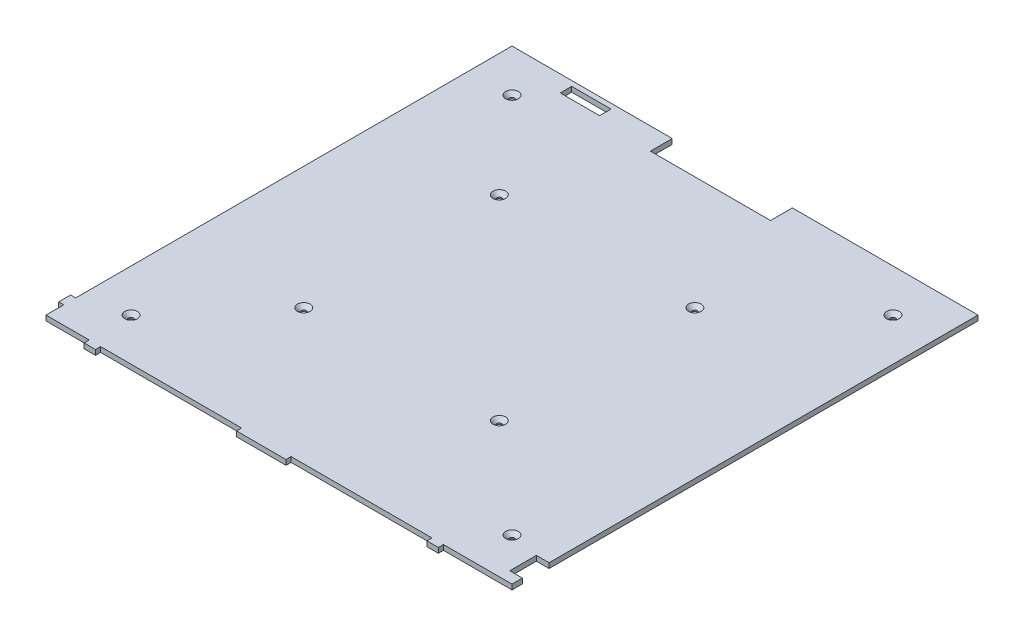
from build123d import *

# Parameters (mm, degrees)
BOSS_EXTRUDE1_DEPTH = 2
SKETCH2_R           = 1
CUT_EXTRUDE1_DEPTH  = 133.597605559
CHAMFER1_SIZE       = 1.5
SKETCH3_W           = 15.5
SKETCH3_H           = 4.5
CUT_EXTRUDE2_DEPTH  = 133.597605559
SKETCH4_W           = 8
SKETCH4_H           = 40
CUT_EXTRUDE3_DEPTH  = 1.3


with BuildPart() as part:
    # Sketch1 → Boss-Extrude1 (new body)
    with BuildSketch(Plane(origin=(0, 0, 0), x_dir=(1, 0, 0), z_dir=(0, 1, 0))):
        Polygon((-74.75, -93.75), (-70.25, -93.75), (-70.25, -91.75), (-14.75, -91.75), (-14.75, -93.75), (4.75, -93.75), (4.75, -91.75), (60.25, -91.75), (60.25, -93.75), (64.75, -93.75), (64.75, -91.75), (91.75, -91.75), (91.75, -87.65), (86.75, -87.65), (86.75, -77.15), (91.75, -77.15), (91.75, 91.75), (18.65, 91.75), (18.65, 83.15), (-28.65, 83.15), (-28.65, 91.75), (-91.75, 91.75), (-91.75, -80.05), (-93.75, -80.05), (-93.75, -84.75), (-91.75, -84.75), (-91.75, -91.75), (-74.75, -91.75), align=None)
    extrude(amount=BOSS_EXTRUDE1_DEPTH)

    # Sketch2 → Cut-Extrude1 (cut, through all)
    with BuildSketch(Plane.XZ):
        with Locations(Location((75, -75, 0), (0, 0, 270))):
            Circle(SKETCH2_R)
        with Locations(Location((-75, -75, 0), (0, 0, 270))):
            Circle(SKETCH2_R)
        with Locations(Location((-75, 75, 0), (0, 0, 270))):
            Circle(SKETCH2_R)
        with Locations(Location((75, 75, 0), (0, 0, 270))):
            Circle(SKETCH2_R)
        with Locations(Location((33.5, 38.5, 0), (0, 0, 270))):
            Circle(SKETCH2_R)
        with Locations(Location((-43.5, 38.5, 0), (0, 0, 270))):
            Circle(SKETCH2_R)
        with Locations(Location((-43.5, -38.5, 0), (0, 0, 270))):
            Circle(SKETCH2_R)
        with Locations(Location((33.5, -38.5, 0), (0, 0, 270))):
            Circle(SKETCH2_R)
    extrude(amount=-CUT_EXTRUDE1_DEPTH, mode=Mode.SUBTRACT)

    # Chamfer1
    chamfer1_edges = [part.edges().sort_by_distance(p)[0] for p in [
        (-75, 2, -74),
        (-75, 2, 76),
        (75, 2, 76),
        (33.5, 2, 39.5),
        (-43.5, 2, 39.5),
        (-43.5, 2, -37.5),
        (33.5, 2, -37.5),
        (75, 2, -74),
    ]]
    chamfer(chamfer1_edges, length=CHAMFER1_SIZE)

    # Sketch3 → Cut-Extrude2 (cut, through all)
    with BuildSketch(Plane.XZ):
        with Locations((-58.5, -87.5)):
            Rectangle(SKETCH3_W, SKETCH3_H)
    extrude(amount=-CUT_EXTRUDE2_DEPTH, mode=Mode.SUBTRACT)

    # Sketch4 → Cut-Extrude3 (cut)
    with BuildSketch(Plane.XZ):
        with Locations((-43.75, -0.25)):
            Rectangle(SKETCH4_W, SKETCH4_H)
    extrude(amount=-CUT_EXTRUDE3_DEPTH, mode=Mode.SUBTRACT)


solid = part.part
